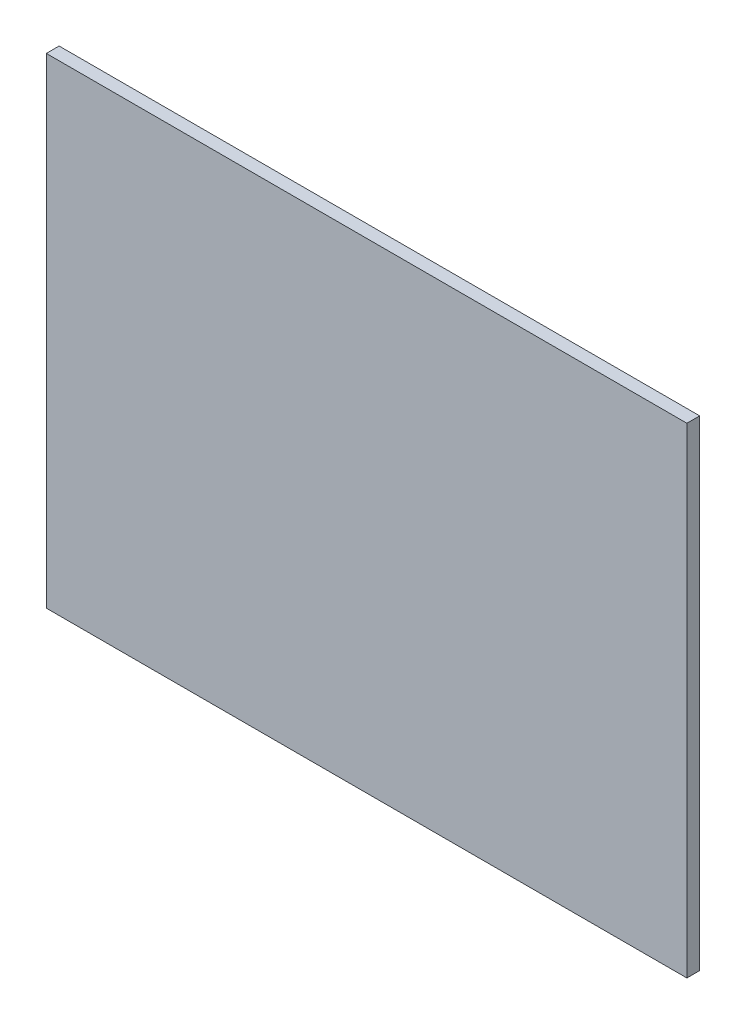
from build123d import *

# Parameters (mm, degrees)
SKETCH1_W           = 500
SKETCH1_H           = 375
BOSS_EXTRUDE1_DEPTH = 10


with BuildPart() as part:
    # Sketch1 → Boss-Extrude1 (new body)
    with BuildSketch(Plane.XY):
        Rectangle(SKETCH1_W, SKETCH1_H)
    extrude(amount=BOSS_EXTRUDE1_DEPTH)


solid = part.part
